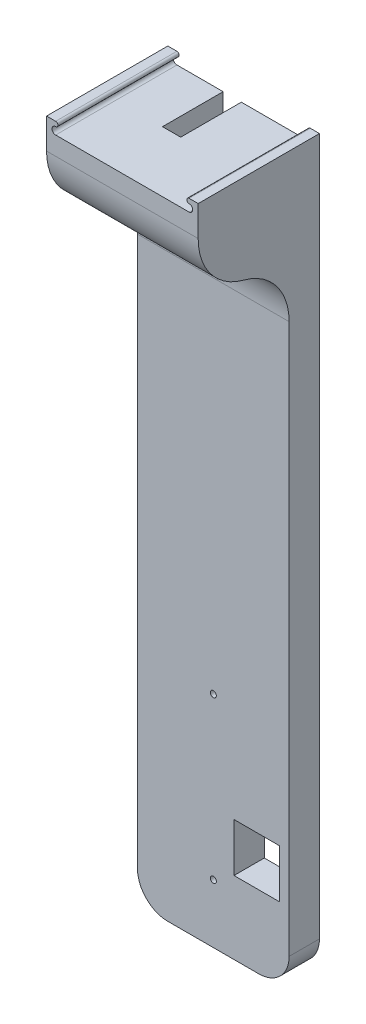
from build123d import *

# Parameters (mm, degrees)
SKICA1_W                 = 25
SKICA1_H                 = 120
P_IDAT_VYSUNUT_M1_DEPTH  = 5
SKICA2_W                 = 25
SKICA2_H                 = 15
P_IDAT_VYSUNUT_M2_DEPTH  = 20
ZAOBLIT5_R               = 5
ZAOBLIT6_R               = 5
ODEBRAT_VYSUNUT_M2_DEPTH = 20
ZAOBLIT7_R               = 10
ZAOBLIT8_R               = 10
SKICA4_W                 = 3
SKICA4_H                 = 10
ODEBRAT_VYSUNUT_M3_DEPTH = 3
ODEBRAT_VYSUNUT_M4_DEPTH = 2
ODEBRAT_START            = -3
SKICA7_R                 = 0.5
ODEBRAT_VYSUNUT_M5_DEPTH = 2.8
SKICA8_R                 = 3.75
ODEBRAT_VYSUNUT_M6_DEPTH = 2
SKICA9_W                 = 7.5
SKICA9_H                 = 8
ODEBRAT_VYSUNUT_M7_DEPTH = 125.197423617


with BuildPart() as part:
    # Skica1 → Přidat vysunutím1 (new body)
    with BuildSketch(Plane.XY):
        with Locations((12.5, 60)):
            Rectangle(SKICA1_W, SKICA1_H)
    extrude(amount=P_IDAT_VYSUNUT_M1_DEPTH)

    # Skica2 → Přidat vysunutím2 (add)
    with BuildSketch(Plane(origin=(0, 0, 0), x_dir=(-1, 0, 0), z_dir=(0, 0, -1))):
        with Locations((-12.5, 112.5)):
            Rectangle(SKICA2_W, SKICA2_H)
    extrude(amount=-P_IDAT_VYSUNUT_M2_DEPTH)

    # Zaoblit5
    zaoblit5_edges = [part.edges().sort_by_distance(p)[0] for p in [
        (25, 0, 2.5),
    ]]
    fillet(zaoblit5_edges, radius=ZAOBLIT5_R)

    # Zaoblit6
    zaoblit6_edges = [part.edges().sort_by_distance(p)[0] for p in [
        (0, 0, 2.5),
    ]]
    fillet(zaoblit6_edges, radius=ZAOBLIT6_R)

    # Skica3 → Odebrat vysunutím2 (cut)
    with BuildSketch(Plane.XY.offset(20)):
        with BuildLine():
            Line((1.5, 118.04), (23.5, 118.04))
            ThreePointArc((23.5, 118.04), (24.1, 118.64), (23.5, 119.24))
            ThreePointArc((23.5, 119.24), (23.12, 119.62), (23.5, 120))
            Line((23.5, 120), (1.5, 120))
            ThreePointArc((1.5, 120), (1.88, 119.62), (1.5, 119.24))
            ThreePointArc((1.5, 119.24), (0.9, 118.64), (1.5, 118.04))
        make_face()
    extrude(amount=-ODEBRAT_VYSUNUT_M2_DEPTH, mode=Mode.SUBTRACT)

    # Zaoblit7
    zaoblit7_edges = [part.edges().sort_by_distance(p)[0] for p in [
        (12.5, 105, 20),
    ]]
    fillet(zaoblit7_edges, radius=ZAOBLIT7_R)

    # Zaoblit8
    zaoblit8_edges = [part.edges().sort_by_distance(p)[0] for p in [
        (12.5, 105, 5),
    ]]
    fillet(zaoblit8_edges, radius=ZAOBLIT8_R)

    # Skica4 → Odebrat vysunutím3 (cut)
    with BuildSketch(Plane(origin=(0, 118.04, 0), x_dir=(1, 0, 0), z_dir=(0, 1, 0))):
        with Locations((10.62, -5)):
            Rectangle(SKICA4_W, SKICA4_H)
    extrude(amount=-ODEBRAT_VYSUNUT_M3_DEPTH, mode=Mode.SUBTRACT)

    # Skica5 → Odebrat vysunutím4 (cut)
    with BuildSketch(Plane.XY):
        Polygon((11, 43), (9.272727273, 24), (15.727272727, 24), (14, 43), align=None)
        with BuildLine():
            Line((5.5, 24), (5.5, 20))
            ThreePointArc((5.5, 20), (3.5, 22), (5.5, 24))
        make_face()
        Polygon((9.09375, 20), (9, 21), (9.272727273, 24), (5.5, 24), (5.5, 20), align=None)
        Polygon((9.272727273, 24), (9, 21), (16, 21), (15.727272727, 24), align=None)
        Polygon((16, 21), (9, 21), (9.09375, 20), (15.90625, 20), align=None)
        Polygon((15.727272727, 24), (16, 21), (15.90625, 20), (19.5, 20), (19.5, 24), align=None)
        with BuildLine():
            ThreePointArc((19.5, 24), (21.5, 22), (19.5, 20))
            Line((19.5, 20), (19.5, 24))
        make_face()
        Polygon((15.90625, 20), (9.09375, 20), (10.5, 5), (14.5, 5), align=None)
    extrude(amount=ODEBRAT_VYSUNUT_M4_DEPTH, mode=Mode.SUBTRACT)

    # Skica7 → Odebrat vysunutím5 (cut)
    with BuildSketch(Plane(origin=(0, 0, 2), x_dir=(-1, 0, 0), z_dir=(0, 0, -1)).offset(ODEBRAT_START)):
        with Locations(Location((-12.5, 36.2, 0), (0, 0, 180))):
            Circle(SKICA7_R)
        with Locations(Location((-12.5, 9.7, 0), (0, 0, 180))):
            Circle(SKICA7_R)
    extrude(amount=ODEBRAT_VYSUNUT_M5_DEPTH, mode=Mode.SUBTRACT)

    # Skica8 → Odebrat vysunutím6 (cut)
    with BuildSketch(Plane(origin=(0, 0, 2), x_dir=(-1, 0, 0), z_dir=(0, 0, -1))):
        with Locations((-12.5, 22)):
            Circle(SKICA8_R)
    extrude(amount=-ODEBRAT_VYSUNUT_M6_DEPTH, mode=Mode.SUBTRACT)

    # Skica9 → Odebrat vysunutím7 (cut, through all)
    with BuildSketch(Plane(origin=(0, 0, 0), x_dir=(-1, 0, 0), z_dir=(0, 0, -1))):
        with Locations((-19.65625, 16)):
            Rectangle(SKICA9_W, SKICA9_H)
    extrude(amount=-ODEBRAT_VYSUNUT_M7_DEPTH, mode=Mode.SUBTRACT)


solid = part.part
